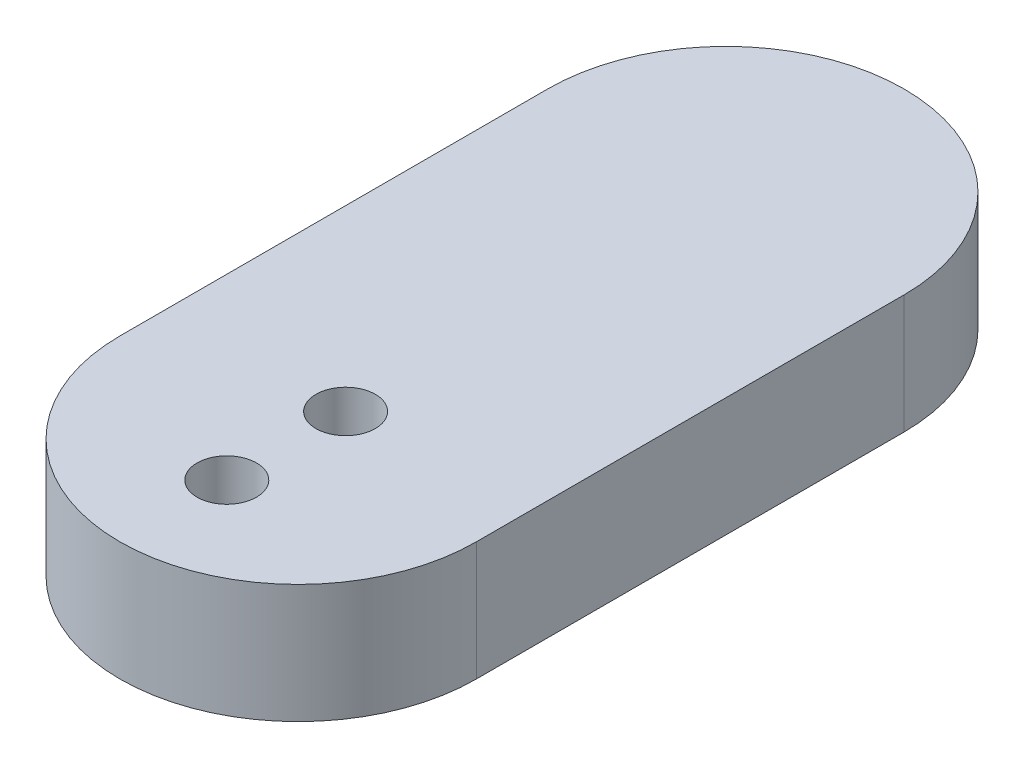
from build123d import *

# Parameters (mm, degrees)
BOSS_EXTRUDE2_DEPTH     = 5
CUT_EXTRUDE2_DEPTH      = 3
CUT_EXTRUDE3_DEPTH      = 24.124843106
CUT_EXTRUDE3_DEPTH_BACK = 3
SKETCH4_R               = 1.25


with BuildPart() as part:
    # Sketch3 → Boss-Extrude2 (new body)
    with BuildSketch(Plane(origin=(0, 0, 0), x_dir=(1, 0, 0), z_dir=(0, 1, 0))):
        with BuildLine():
            Line((-0.462577175, 10.231940285), (-0.462577175, -7.768059715))
            ThreePointArc((-0.462577175, -7.768059715), (7.037422825, -15.268059715), (14.537422825, -7.768059715))
            Line((14.537422825, -7.768059715), (14.537422825, 10.231940285))
            ThreePointArc((14.537422825, 10.231940285), (7.037422825, 17.731940285), (-0.462577175, 10.231940285))
        make_face()
    extrude(amount=BOSS_EXTRUDE2_DEPTH)

    # Sketch2 → Cut-Extrude2 (cut)
    with BuildSketch(Plane(origin=(0, 0, 0), x_dir=(1, 0, 0), z_dir=(0, 1, 0))):
        with BuildLine():
            Line((1.037422825, 10.231940285), (1.037422825, -7.768059715))
            ThreePointArc((1.037422825, -7.768059715), (7.037422825, -13.768059715), (13.037422825, -7.768059715))
            Line((13.037422825, -7.768059715), (13.037422825, 10.231940285))
            ThreePointArc((13.037422825, 10.231940285), (7.037422825, 16.231940285), (1.037422825, 10.231940285))
        make_face()
    extrude(amount=CUT_EXTRUDE2_DEPTH, mode=Mode.SUBTRACT)

    # Sketch4 → Cut-Extrude3 (cut, two sides: drawn at the far end of the back side and taken through both)
    with BuildSketch(Plane.XZ.offset(-3).offset(-CUT_EXTRUDE3_DEPTH_BACK)):
        with Locations(Location((7.037422825, 10.768059715, 0), (0, 0, 90))):
            Circle(SKETCH4_R)
        with Locations(Location((7.037422825, 5.768059715, 0), (0, 0, 90))):
            Circle(SKETCH4_R)
    extrude(amount=CUT_EXTRUDE3_DEPTH + CUT_EXTRUDE3_DEPTH_BACK, mode=Mode.SUBTRACT)


solid = part.part
